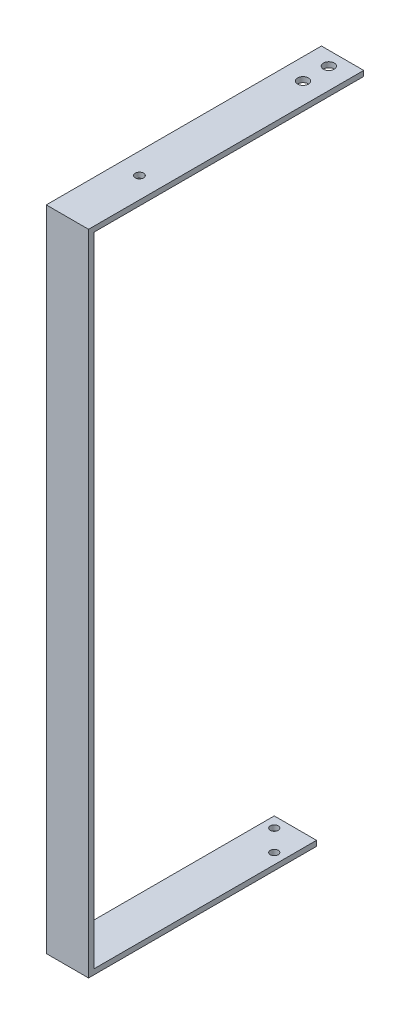
from build123d import *

# Parameters (mm, degrees)
CROQUIS1_W              = 50.8
CROQUIS1_H              = 6.31
SALIENTE_EXTRUIR1_DEPTH = 273.99
CROQUIS2_W              = 50.8
CROQUIS2_H              = 6.31
SALIENTE_EXTRUIR2_DEPTH = 772.95
CROQUIS3_W              = 50.8
CROQUIS3_H              = 6.31
SALIENTE_EXTRUIR3_DEPTH = 324.39
CROQUIS4_R              = 4.7625
CORTAR_EXTRUIR1_DEPTH   = 10
CROQUIS5_R              = 6.5
CORTAR_EXTRUIR2_DEPTH   = 10
CROQUIS6_R              = 5
CORTAR_EXTRUIR3_DEPTH   = 35


with BuildPart() as part:
    # Croquis1 → Saliente-Extruir1 (new body)
    with BuildSketch(Plane.XY):
        Rectangle(CROQUIS1_W, CROQUIS1_H)
    extrude(amount=SALIENTE_EXTRUIR1_DEPTH)

    # Croquis2 → Saliente-Extruir2 (add)
    with BuildSketch(Plane(origin=(0, 3.155, 0), x_dir=(1, 0, 0), z_dir=(0, 1, 0))):
        with Locations((0, -270.835)):
            Rectangle(CROQUIS2_W, CROQUIS2_H)
    extrude(amount=SALIENTE_EXTRUIR2_DEPTH)

    # Croquis3 → Saliente-Extruir3 (add)
    with BuildSketch(Plane(origin=(0, 0, 267.68), x_dir=(-1, 0, 0), z_dir=(0, 0, -1))):
        with Locations((0, 772.95)):
            Rectangle(CROQUIS3_W, CROQUIS3_H)
    extrude(amount=SALIENTE_EXTRUIR3_DEPTH)

    # Croquis4 → Cortar-Extruir1 (cut)
    with BuildSketch(Plane.XZ.offset(3.155)):
        with Locations((-12.7, 12.7)):
            Circle(CROQUIS4_R)
        with Locations((12.7, 38.1)):
            Circle(CROQUIS4_R)
    extrude(amount=-CORTAR_EXTRUIR1_DEPTH, mode=Mode.SUBTRACT)

    # Croquis5 → Cortar-Extruir2 (cut)
    with BuildSketch(Plane(origin=(0, 776.105, 0), x_dir=(1, 0, 0), z_dir=(0, 1, 0))):
        with Locations(Location((0, 40.21, 0), (0, 0, 180))):
            Circle(CROQUIS5_R)
        with Locations(Location((0, 9.21, 0), (0, 0, 180))):
            Circle(CROQUIS5_R)
    extrude(amount=-CORTAR_EXTRUIR2_DEPTH, mode=Mode.SUBTRACT)

    # Croquis6 → Cortar-Extruir3 (cut)
    with BuildSketch(Plane(origin=(0, 776.105, 0), x_dir=(1, 0, 0), z_dir=(0, 1, 0))):
        with Locations(Location((0, -187.48, 0), (0, 0, 180))):
            Circle(CROQUIS6_R)
    extrude(amount=-CORTAR_EXTRUIR3_DEPTH, mode=Mode.SUBTRACT)


solid = part.part
